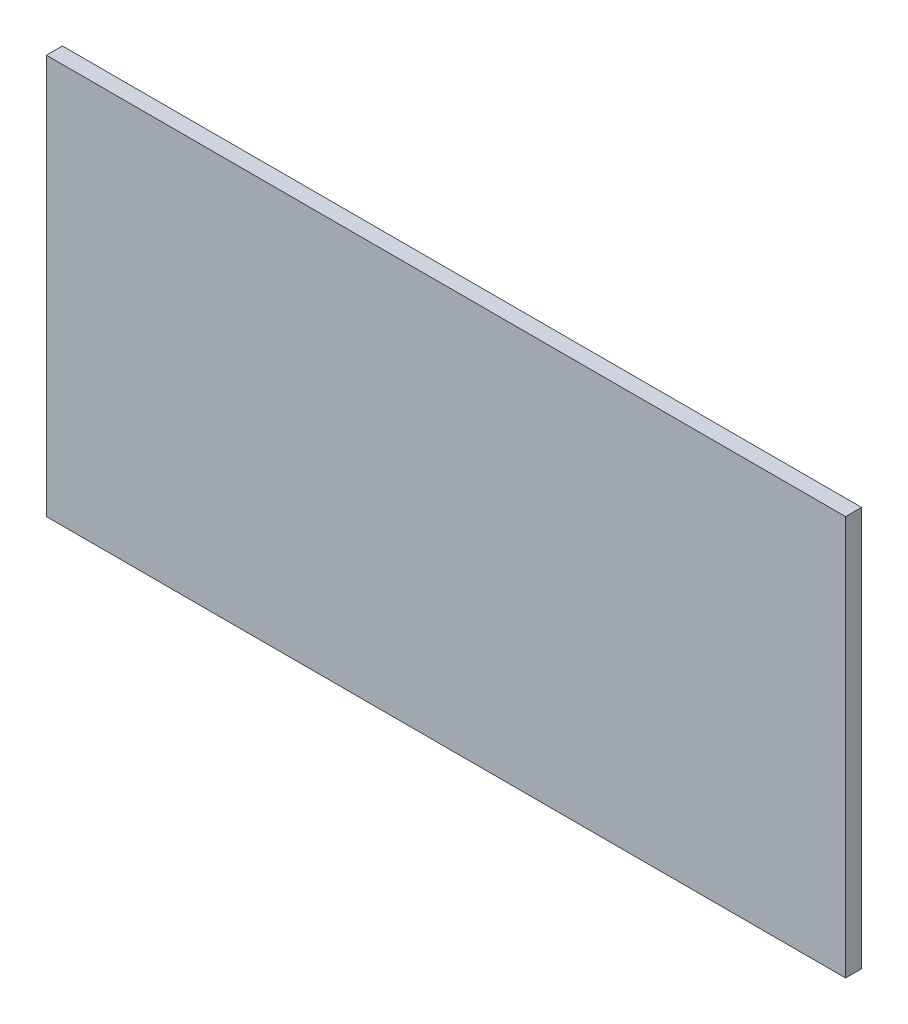
from build123d import *

# Parameters (mm, degrees)
SKETCH_1_W      = 800
SKETCH_1_H      = 400
EXTRUDE_1_DEPTH = 16


with BuildPart() as part:
    # 草图1 → 凸台-拉伸1 (new body)
    with BuildSketch(Plane.XY):
        Rectangle(SKETCH_1_W, SKETCH_1_H)
    extrude(amount=EXTRUDE_1_DEPTH)


solid = part.part
